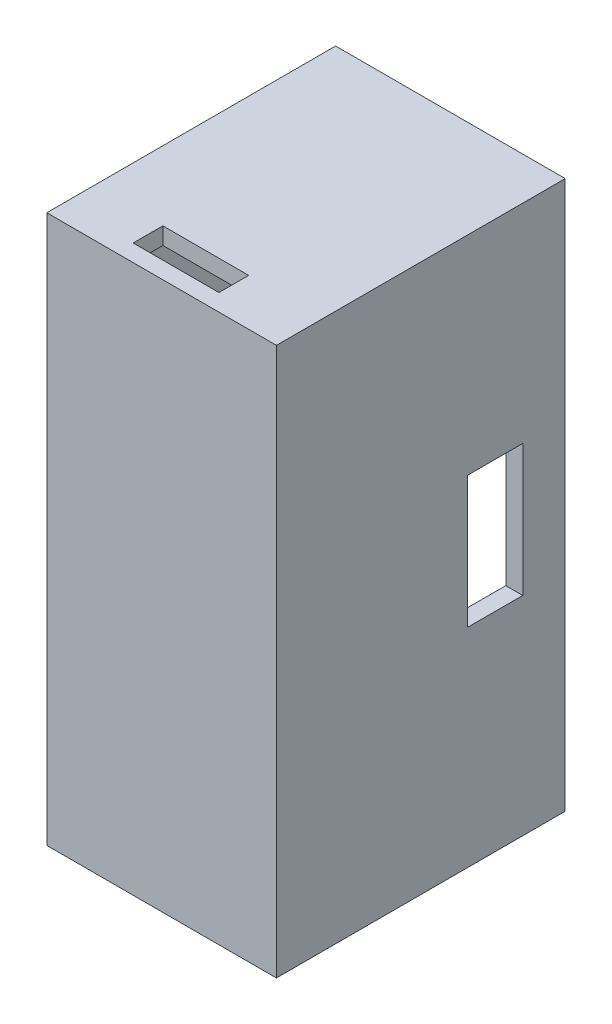
from build123d import *

# Parameters (mm, degrees)
SKETCH1_3_W         = 27.034600944
SKETCH1_3_H         = 64.50289226
BOSS_EXTRUDE2_DEPTH = 2
SKETCH1_4_W         = 27.034600944
SKETCH1_4_H         = 64.50289226
SKETCH1_4_R         = 2.5
SKETCH1_4_W_2       = 18.5
SKETCH1_4_H_2       = 23
SKETCH1_4_R_2       = 0.75
BOSS_EXTRUDE3_DEPTH = 3
SKETCH1_R           = 2.5
SKETCH1_R_2         = 0.75
BOSS_EXTRUDE6_DEPTH = 12
CUT_EXTRUDE1_START  = -3
SKETCH2_W           = 10.1
SKETCH2_H           = 7
SKETCH2_H_2         = 5.610263073
CUT_EXTRUDE1_DEPTH  = 3.5
BOSS_EXTRUDE7_DEPTH = 18.5
SKETCH5_W           = 27.034600944
SKETCH5_H           = 64.50289226
SKETCH5_W_2         = 23.034600944
SKETCH5_H_2         = 59.50289226
BOSS_EXTRUDE9_DEPTH = 29
SKETCH6_W           = 23.034600944
SKETCH6_H           = 1
CUT_EXTRUDE2_DEPTH  = 0.5
CUT_EXTRUDE3_REACH  = 75.262
SKETCH8_W           = 14.7
SKETCH8_H           = 8.1
CUT_EXTRUDE4_REACH  = 64.464
SKETCH9_W           = 6.5
SKETCH9_H           = 15.5
SKETCH11_W          = 10.1
SKETCH11_H          = 2
CUT_EXTRUDE5_DEPTH  = 0.5


with BuildPart() as part:
    # Sketch1<3> → Boss-Extrude2 (new body)
    with BuildSketch(Plane.XY):
        with Locations((0, 14.082400554)):
            Rectangle(SKETCH1_3_W, SKETCH1_3_H)
    extrude(amount=BOSS_EXTRUDE2_DEPTH)

    # Sketch1<4> → Boss-Extrude3 (add)
    # profile 1 of 15: a face of its own
    with BuildSketch(Plane.XY):
        with Locations((0, 14.082400554)):
            Rectangle(SKETCH1_4_W, SKETCH1_4_H)
        with Locations((-8.75, -8.667715428)):
            Circle(SKETCH1_4_R, mode=Mode.SUBTRACT)
        with Locations((8.75, -8.667715428)):
            Circle(SKETCH1_4_R, mode=Mode.SUBTRACT)
        with Locations((8.75, 13.832284572)):
            Circle(SKETCH1_4_R, mode=Mode.SUBTRACT)
        with Locations((-8.75, 13.832284572)):
            Circle(SKETCH1_4_R, mode=Mode.SUBTRACT)
        with Locations((0, 32.833846684)):
            Rectangle(SKETCH1_4_W_2, SKETCH1_4_H_2, mode=Mode.SUBTRACT)
    # profile 2 of 15: a face of its own
    with BuildSketch(Plane.XY):
        with Locations((8.75, 13.832284572)):
            Circle(SKETCH1_4_R)
        with Locations((8.75, 13.832284572)):
            Circle(SKETCH1_4_R_2, mode=Mode.SUBTRACT)
    # profile 3 of 15: a face of its own
    with BuildSketch(Plane.XY):
        with Locations((8.75, 13.832284572)):
            Circle(SKETCH1_4_R_2)
    # profile 4 of 15: a face of its own
    with BuildSketch(Plane.XY):
        with Locations((-8.75, 13.832284572)):
            Circle(SKETCH1_4_R)
        with Locations((-8.75, 13.832284572)):
            Circle(SKETCH1_4_R_2, mode=Mode.SUBTRACT)
    # profile 5 of 15: a face of its own
    with BuildSketch(Plane.XY):
        with Locations((-8.75, 13.832284572)):
            Circle(SKETCH1_4_R_2)
    # profile 6 of 15: a face of its own
    with BuildSketch(Plane.XY):
        with BuildLine():
            ThreePointArc((-6.278285008, -8.292715428), (-8.75, -6.167715428), (-11.221714992, -8.292715428))
            Line((-11.221714992, -8.292715428), (-9.399519053, -8.292715428))
            ThreePointArc((-9.399519053, -8.292715428), (-8.75, -7.917715428), (-8.100480947, -8.292715428))
            Line((-8.100480947, -8.292715428), (-6.278285008, -8.292715428))
        make_face()
    # profile 7 of 15: a face of its own
    with BuildSketch(Plane.XY):
        with BuildLine():
            Line((-9.399519053, -8.292715428), (-11.221714992, -8.292715428))
            ThreePointArc((-11.221714992, -8.292715428), (-8.938032605, -11.160634147), (-6.25, -8.667715428))
            ThreePointArc((-6.25, -8.667715428), (-6.257081281, -8.479682824), (-6.278285008, -8.292715428))
            Line((-6.278285008, -8.292715428), (-8.100480947, -8.292715428))
            ThreePointArc((-8.100480947, -8.292715428), (-8.02555563, -8.473601145), (-8, -8.667715428))
            ThreePointArc((-8, -8.667715428), (-8.944114284, -9.392159798), (-9.399519053, -8.292715428))
        make_face()
    # profile 8 of 15: a face of its own
    with BuildSketch(Plane.XY):
        with BuildLine():
            ThreePointArc((-8.100480947, -8.292715428), (-8.75, -7.917715428), (-9.399519053, -8.292715428))
            Line((-9.399519053, -8.292715428), (-8.100480947, -8.292715428))
        make_face()
    # profile 9 of 15: a face of its own
    with BuildSketch(Plane.XY):
        with BuildLine():
            Line((-8.100480947, -8.292715428), (-9.399519053, -8.292715428))
            ThreePointArc((-9.399519053, -8.292715428), (-8.944114284, -9.392159798), (-8, -8.667715428))
            ThreePointArc((-8, -8.667715428), (-8.02555563, -8.473601145), (-8.100480947, -8.292715428))
        make_face()
    # profile 10 of 15: a face of its own
    with BuildSketch(Plane.XY):
        with BuildLine():
            ThreePointArc((-6.278285008, -8.292715428), (-8.75, -6.167715428), (-11.221714992, -8.292715428))
            Line((-11.221714992, -8.292715428), (-9.399519053, -8.292715428))
            ThreePointArc((-9.399519053, -8.292715428), (-8.75, -7.917715428), (-8.100480947, -8.292715428))
            Line((-8.100480947, -8.292715428), (-6.278285008, -8.292715428))
        make_face()
    # profile 11 of 15: a face of its own
    with BuildSketch(Plane.XY):
        with BuildLine():
            Line((-9.399519053, -8.292715428), (-11.221714992, -8.292715428))
            ThreePointArc((-11.221714992, -8.292715428), (-8.938032605, -11.160634147), (-6.25, -8.667715428))
            ThreePointArc((-6.25, -8.667715428), (-6.257081281, -8.479682824), (-6.278285008, -8.292715428))
            Line((-6.278285008, -8.292715428), (-8.100480947, -8.292715428))
            ThreePointArc((-8.100480947, -8.292715428), (-8.02555563, -8.473601145), (-8, -8.667715428))
            ThreePointArc((-8, -8.667715428), (-8.944114284, -9.392159798), (-9.399519053, -8.292715428))
        make_face()
    # profile 12 of 15: a face of its own
    with BuildSketch(Plane.XY):
        with BuildLine():
            ThreePointArc((-8.100480947, -8.292715428), (-8.75, -7.917715428), (-9.399519053, -8.292715428))
            Line((-9.399519053, -8.292715428), (-8.100480947, -8.292715428))
        make_face()
    # profile 13 of 15: a face of its own
    with BuildSketch(Plane.XY):
        with BuildLine():
            Line((-8.100480947, -8.292715428), (-9.399519053, -8.292715428))
            ThreePointArc((-9.399519053, -8.292715428), (-8.944114284, -9.392159798), (-8, -8.667715428))
            ThreePointArc((-8, -8.667715428), (-8.02555563, -8.473601145), (-8.100480947, -8.292715428))
        make_face()
    # profile 14 of 15: a face of its own
    with BuildSketch(Plane.XY):
        with Locations((8.75, -8.667715428)):
            Circle(SKETCH1_4_R)
        with Locations((8.75, -8.667715428)):
            Circle(SKETCH1_4_R_2, mode=Mode.SUBTRACT)
    # profile 15 of 15: a face of its own
    with BuildSketch(Plane.XY):
        with Locations((8.75, -8.667715428)):
            Circle(SKETCH1_4_R_2)
    extrude(amount=-BOSS_EXTRUDE3_DEPTH)

    # Sketch1 → Boss-Extrude6 (add)
    # profile 1 of 4: a face of its own
    with BuildSketch(Plane.XY):
        with BuildLine():
            Line((-9.399519053, -8.292715428), (-11.221714992, -8.292715428))
            ThreePointArc((-11.221714992, -8.292715428), (-8.75, -11.167715428), (-6.278285008, -8.292715428))
            Line((-6.278285008, -8.292715428), (-8.100480947, -8.292715428))
            ThreePointArc((-8.100480947, -8.292715428), (-8.75, -9.417715428), (-9.399519053, -8.292715428))
        make_face()
    # profile 2 of 4: a face of its own
    with BuildSketch(Plane.XY):
        with Locations((-8.75, 13.832284572)):
            Circle(SKETCH1_R)
        with Locations((-8.75, 13.832284572)):
            Circle(SKETCH1_R_2, mode=Mode.SUBTRACT)
    # profile 3 of 4: a face of its own
    with BuildSketch(Plane.XY):
        with Locations((8.75, 13.832284572)):
            Circle(SKETCH1_R)
        with Locations((8.75, 13.832284572)):
            Circle(SKETCH1_R_2, mode=Mode.SUBTRACT)
    # profile 4 of 4: a face of its own
    with BuildSketch(Plane.XY):
        with Locations((8.75, -8.667715428)):
            Circle(SKETCH1_R)
        with Locations((8.75, -8.667715428)):
            Circle(SKETCH1_R_2, mode=Mode.SUBTRACT)
    extrude(amount=-BOSS_EXTRUDE6_DEPTH)

    # Sketch2 → Cut-Extrude1 (cut)
    with BuildSketch(Plane(origin=(0, 0, -3), x_dir=(-1, 0, 0), z_dir=(0, 0, -1)).offset(CUT_EXTRUDE1_START)):
        with Locations((0.3, 40.833846684)):
            Rectangle(SKETCH2_W, SKETCH2_H)
        with Locations((0.3, 47.138978221)):
            Rectangle(SKETCH2_W, SKETCH2_H_2)
    extrude(amount=CUT_EXTRUDE1_DEPTH, mode=Mode.SUBTRACT)

    # Sketch4 → Boss-Extrude7 (add)
    with BuildSketch(Plane.ZY.offset(-9.25)):
        Polygon((-3, 22.333846684), (-3, 21.333846684), (-2.422649731, 21.333846684), align=None)
        Polygon((-3, 20.267009218), (-3, 21.333846684), (-3, 22.333846684), (-4, 21.333846684), (-4, 20.630979452), align=None)
    extrude(amount=BOSS_EXTRUDE7_DEPTH)

    # Sketch5 → Boss-Extrude9 (add)
    with BuildSketch(Plane(origin=(0, 0, -3), x_dir=(-1, 0, 0), z_dir=(0, 0, -1))):
        with Locations((0, 14.082400554)):
            Rectangle(SKETCH5_W, SKETCH5_H)
        with Locations((0, 14.582400554)):
            Rectangle(SKETCH5_W_2, SKETCH5_H_2, mode=Mode.SUBTRACT)
    extrude(amount=BOSS_EXTRUDE9_DEPTH)

    # Sketch6 → Cut-Extrude2 (cut)
    with BuildSketch(Plane(origin=(0, -15.169045576, 0), x_dir=(1, 0, 0), z_dir=(0, 1, 0))):
        with Locations((0, 31)):
            Rectangle(SKETCH6_W, SKETCH6_H)
    extrude(amount=-CUT_EXTRUDE2_DEPTH, mode=Mode.SUBTRACT)

    # Sketch8 → Cut-Extrude3 (cut, up to next)
    with BuildSketch(Plane.XZ.offset(18.169045576), mode=Mode.PRIVATE) as cut_extrude3_sk1:
        with Locations((0, -23.95)):
            Rectangle(SKETCH8_W, SKETCH8_H)
    cut_extrude3_tool1 = extrude(cut_extrude3_sk1.sketch, amount=-CUT_EXTRUDE3_REACH, mode=Mode.PRIVATE) & part.part
    add(cut_extrude3_tool1.solids().sort_by_distance((0, -18.169046, -23.95))[0], mode=Mode.SUBTRACT)

    # Sketch9 → Cut-Extrude4 (cut, up to next)
    with BuildSketch(Plane(origin=(13.517300472, 0, 0), x_dir=(0, 0, -1), z_dir=(1, 0, 0)), mode=Mode.PRIVATE) as cut_extrude4_sk1:
        with Locations((23.75, 14.082400554)):
            Rectangle(SKETCH9_W, SKETCH9_H)
    cut_extrude4_tool1 = extrude(cut_extrude4_sk1.sketch, amount=-CUT_EXTRUDE4_REACH, mode=Mode.PRIVATE) & part.part
    add(cut_extrude4_tool1.solids().sort_by_distance((13.5173, 14.082401, -23.75))[0], mode=Mode.SUBTRACT)

    # Sketch11 → Cut-Extrude5 (cut)
    with BuildSketch(Plane.XY.offset(-3)):
        with Locations((-0.3, 45.333846684)):
            Rectangle(SKETCH11_W, SKETCH11_H)
    extrude(amount=-CUT_EXTRUDE5_DEPTH, mode=Mode.SUBTRACT)


solid = part.part
